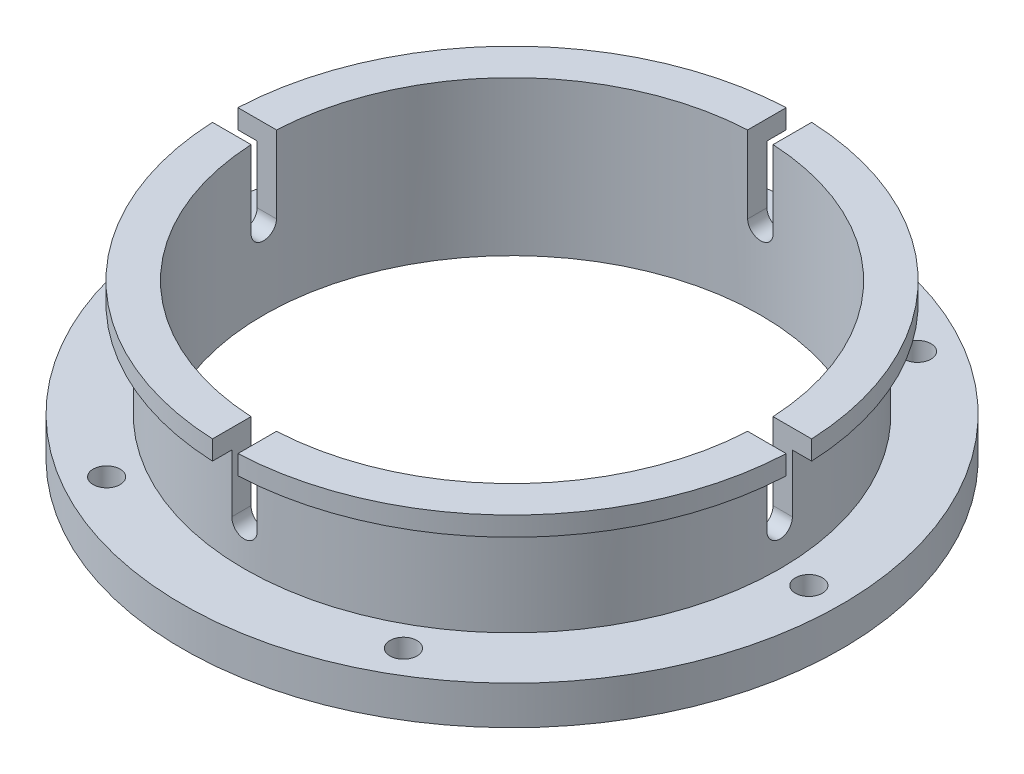
from build123d import *

# Parameters (mm, degrees)
CUT_EXTRUDE1_DEPTH = 64.679863379
CIRPATTERN1_COUNT  = 4
SKETCH4_R          = 1.75
CUT_EXTRUDE2_DEPTH = 10
CIRPATTERN2_COUNT  = 6


with BuildPart() as part:
    # Sketch2 → Revolve1 (revolve)
    with BuildSketch(Plane.XY, mode=Mode.PRIVATE) as revolve1_sk:
        Polygon((-32.25, 20), (-32.25, 0), (-42.75, 0), (-42.75, 5), (-34.75, 5), (-34.75, 17.5), (-37.25, 17.5), (-37.25, 20), align=None)
    revolve(revolve1_sk.sketch.rotate(Axis((0, 0, 0), (0, 1, 0)), 270), axis=Axis((0, 0, 0), (0, 1, 0)))

    # Sketch3 → Cut-Extrude1 (cut, symmetric)
    with BuildSketch(Plane(origin=(0, 0, 0), x_dir=(0, 0, -1), z_dir=(1, 0, 0))):
        with BuildLine():
            Line((-1.65, 29.999999659), (1.65, 29.999999659))
            Line((1.65, 29.999999659), (1.65, 10.000000341))
            ThreePointArc((1.65, 10.000000341), (0, 8.35), (-1.65, 10.000000341))
            Line((-1.65, 10.000000341), (-1.65, 29.999999659))
        make_face()
    cut_extrude1 = extrude(amount=CUT_EXTRUDE1_DEPTH, both=True, mode=Mode.SUBTRACT)

    # CirPattern1: Cut-Extrude1 ×4 about axis
    cirpattern1_axis = Axis((0, 0, 0), (0, -1, 0))
    for i in range(1, CIRPATTERN1_COUNT):
        add(cut_extrude1.rotate(cirpattern1_axis, i * 360 / CIRPATTERN1_COUNT), mode=Mode.SUBTRACT)

    # Sketch4 → Cut-Extrude2 (cut)
    with BuildSketch(Plane(origin=(0, 5, 0), x_dir=(1, 0, 0), z_dir=(0, 1, 0))):
        with Locations(Location((-38.5, 0, 0), (0, 0, 270))):
            Circle(SKETCH4_R)
    cut_extrude2 = extrude(amount=-CUT_EXTRUDE2_DEPTH, mode=Mode.SUBTRACT)

    # CirPattern2: Cut-Extrude2 ×6 about axis
    cirpattern2_axis = Axis((0, 0, 0), (0, 1, 0))
    for i in range(1, CIRPATTERN2_COUNT):
        add(cut_extrude2.rotate(cirpattern2_axis, i * 360 / CIRPATTERN2_COUNT), mode=Mode.SUBTRACT)


solid = part.part
